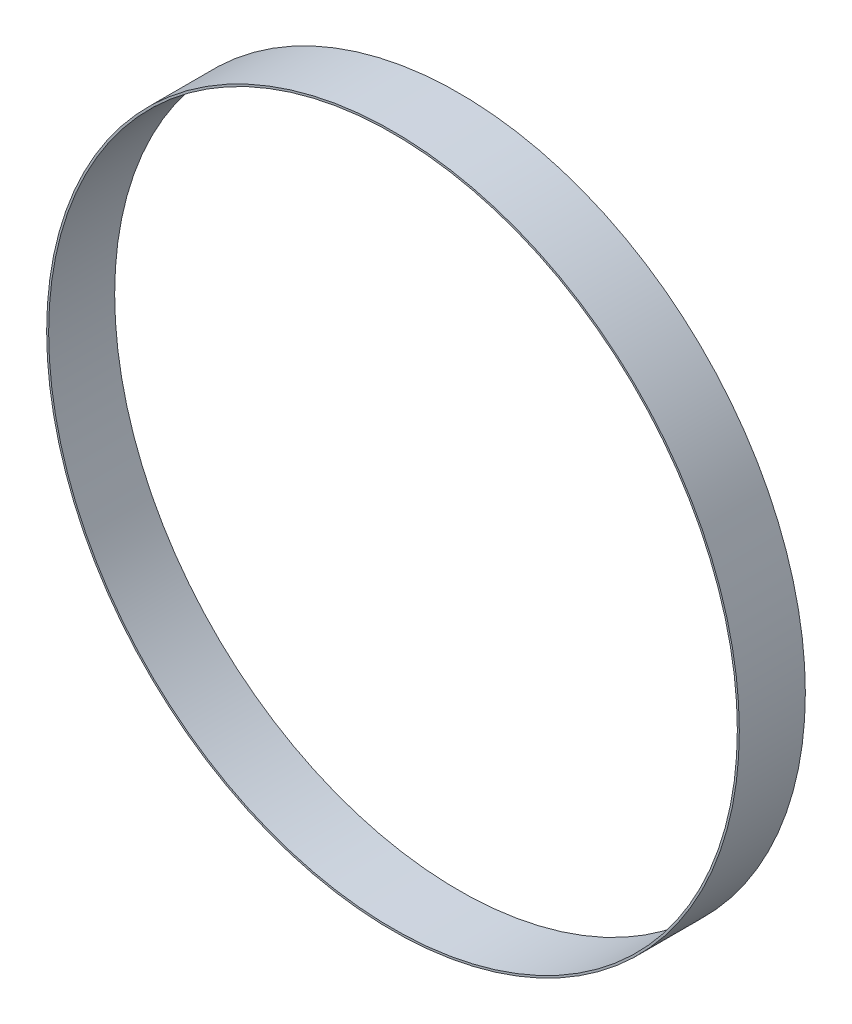
from build123d import *

# Parameters (mm, degrees)
SKETCH1_R           = 524.5
SKETCH1_R_2         = 521.5
BOSS_EXTRUDE1_DEPTH = 100


with BuildPart() as part:
    # Sketch1 → Boss-Extrude1 (new body)
    with BuildSketch(Plane.XY):
        Circle(SKETCH1_R)
        Circle(SKETCH1_R_2, mode=Mode.SUBTRACT)
    extrude(amount=BOSS_EXTRUDE1_DEPTH)


solid = part.part
